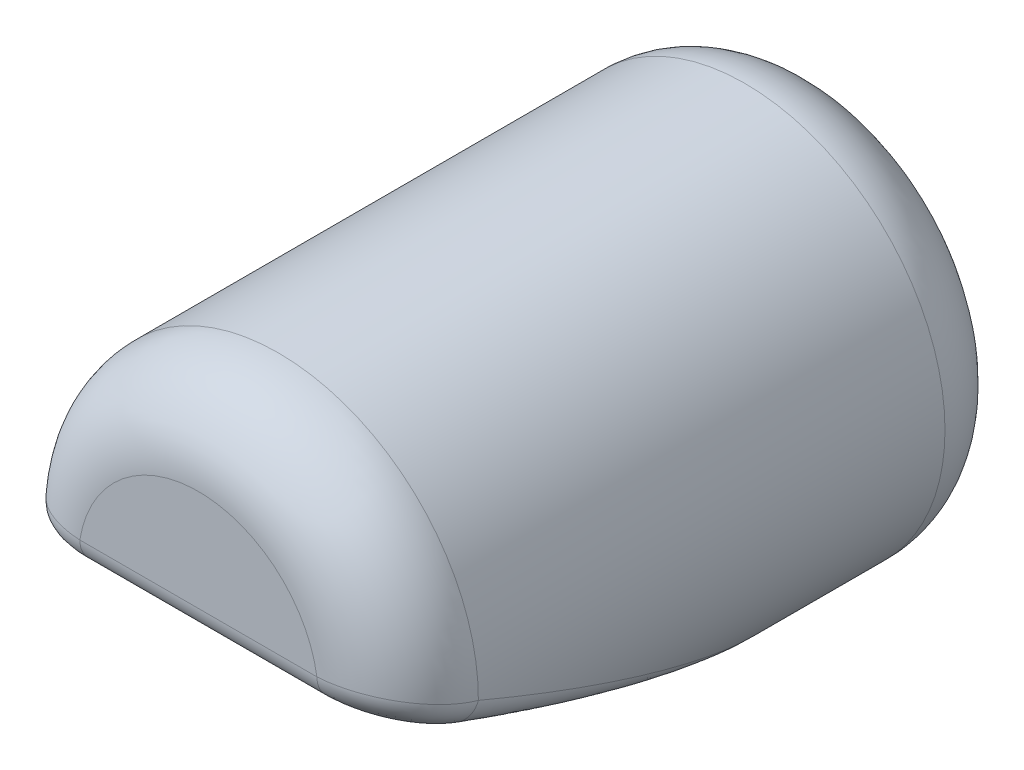
from build123d import *
from build123d.topology import SkipClean

# Parameters (mm, degrees)
SKETCH2_R               = 7.5
BOSS_EXTRUDE1_DEPTH     = 23.5
FILLET1_R               = 3
CUT_EXTRUDE1_DEPTH      = 10
CUT_EXTRUDE1_DEPTH_BACK = 10
FILLET2_R               = 1


with BuildPart() as part:
    # Sketch2 → Boss-Extrude1 (new body)
    with BuildSketch(Plane.XY):
        Circle(SKETCH2_R)
    extrude(amount=BOSS_EXTRUDE1_DEPTH)

    # Fillet1
    fillet1_edges = [part.edges().sort_by_distance(p)[0] for p in [
        (-7.5, 0, 23.5),
        (-7.5, 0, 0),
    ]]
    fillet(fillet1_edges, radius=FILLET1_R)

    # Sketch3 → Cut-Extrude1 (cut, two sides: drawn at the far end of the back side and taken through both)
    with SkipClean():  # the faces are left unmerged after this step: merging them gives an invalid solid
        with BuildSketch(Plane(origin=(0, 0, 0), x_dir=(0, 0, -1), z_dir=(1, 0, 0)).offset(-CUT_EXTRUDE1_DEPTH_BACK)):
            Polygon((-23.5, 0), (-3, -7.5), (-3, -10.4048104), (-23.5, -10.4048104), align=None)
        extrude(amount=CUT_EXTRUDE1_DEPTH + CUT_EXTRUDE1_DEPTH_BACK, mode=Mode.SUBTRACT)

    # Fillet2
    fillet2_edges = [part.edges().sort_by_distance(p)[0] for p in [
        (5.846040718, -4.698277123, 10.658042531),
        (6.641924558, -0.332189691, 22.592014844),
        (-5.846040728, -4.69827711, 10.658042566),
        (-6.641924558, -0.332189691, 22.592014844),
        (0, 0, 23.5),
    ]]
    fillet(fillet2_edges, radius=FILLET2_R)


solid = part.part
